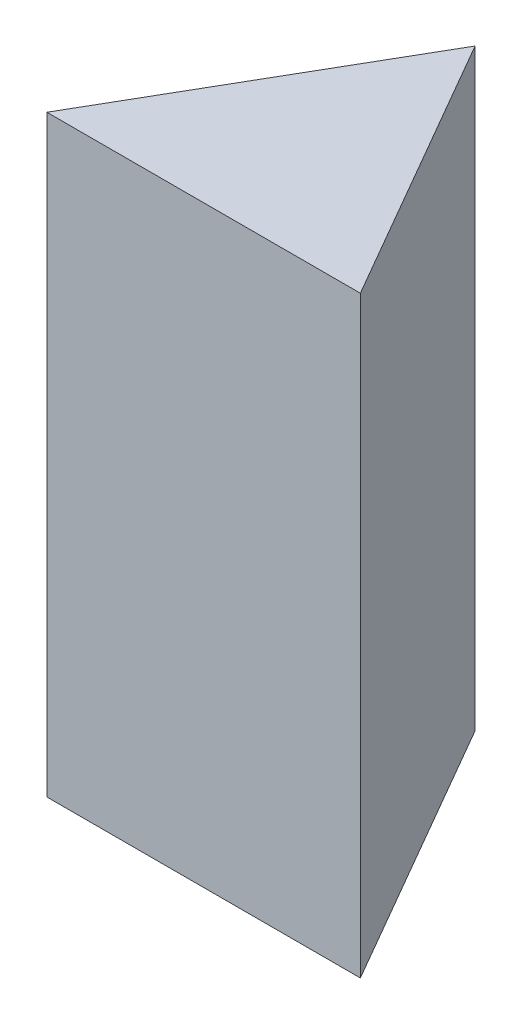
from build123d import *

# Parameters (mm, degrees)
EXTRUDE_1_DEPTH = 70


with BuildPart() as part:
    # 草图1 → 凸台-拉伸1 (new body)
    with BuildSketch(Plane(origin=(25.697299473, -344.600895184, 0), x_dir=(1, 0, 0), z_dir=(0, 1, 0))):
        Polygon((-3.528956009, 18.184745951), (-22.028956009, -13.858193989), (14.971043991, -13.858193989), align=None)
    extrude(amount=EXTRUDE_1_DEPTH)


solid = part.part
